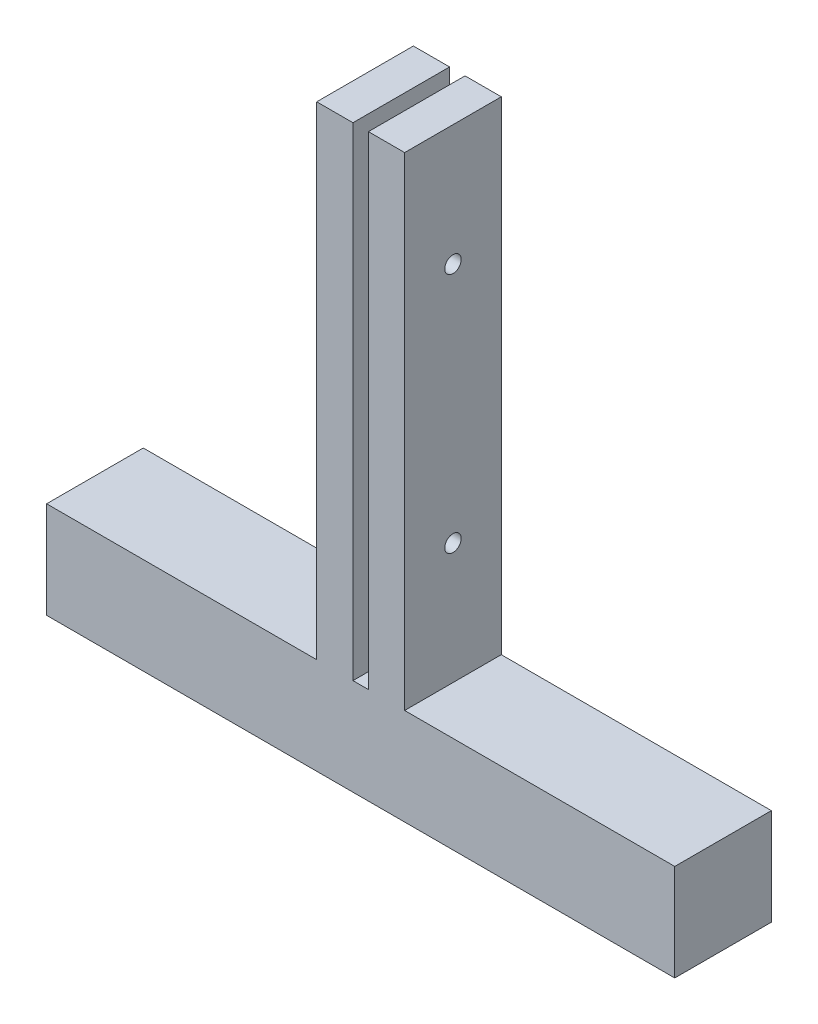
from build123d import *

# Parameters (mm, degrees)
BOSS_EXTRUDE3_DEPTH     = 20
CUT_EXTRUDE1_DEPTH      = 88
CUT_EXTRUDE1_DEPTH_BACK = 161
SKETCH3_R               = 1.7


with BuildPart() as part:
    # Sketch1 → Boss-Extrude3 (new body)
    with BuildSketch(Plane.XY):
        Polygon((0, 0), (65, 0), (65, 20), (9.1, 20), (9.1, 120), (1.6, 120), (1.6, 20), (-1.6, 20), (-1.6, 120), (-9.1, 120), (-9.1, 20), (-65, 20), (-65, 0), align=None)
    extrude(amount=BOSS_EXTRUDE3_DEPTH)

    # Sketch3 → Cut-Extrude1 (cut, two sides: drawn at the far end of the back side and taken through both)
    with BuildSketch(Plane(origin=(9.1, 0, 0), x_dir=(0, 0, -1), z_dir=(1, 0, 0)).offset(-CUT_EXTRUDE1_DEPTH_BACK)):
        with Locations(Location((-10, 95, 0), (0, 0, 180))):
            Circle(SKETCH3_R)
        with Locations(Location((-10, 45, 0), (0, 0, 180))):
            Circle(SKETCH3_R)
    extrude(amount=CUT_EXTRUDE1_DEPTH + CUT_EXTRUDE1_DEPTH_BACK, mode=Mode.SUBTRACT)


solid = part.part
